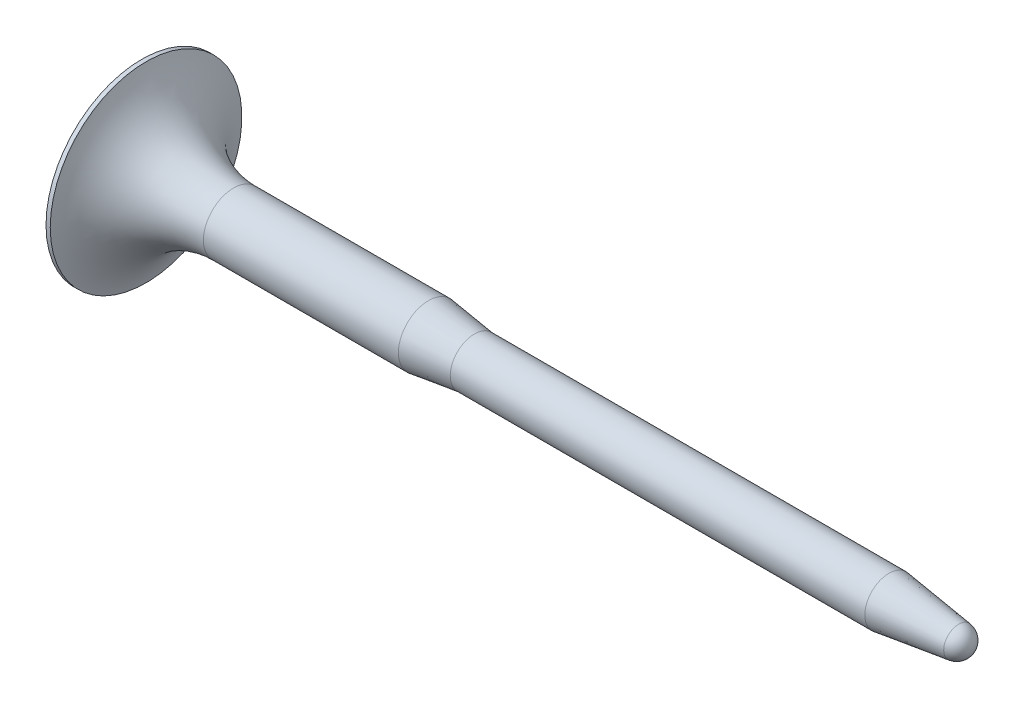
from build123d import *


with BuildPart() as part:
    # Sketch1 → Revolve1 (revolve)
    with BuildSketch(Plane.XY, mode=Mode.PRIVATE) as revolve1_sk:
        with BuildLine():
            Line((0, -4.03225), (0, 0))
            Line((0, 0), (34.925, 0))
            ThreePointArc((34.925, 0), (34.767418278, -0.418684593), (34.372884132, -0.629567487))
            Line((34.372884132, -0.629567487), (31.437637782, -1.016))
            Line((31.437637782, -1.016), (13.994321545, -1.016))
            Line((13.994321545, -1.016), (12.065, -1.27))
            Line((12.065, -1.27), (3.8608, -1.27))
            ThreePointArc((3.8608, -1.27), (1.558925, -2.037291667), (0.1778, -4.03225))
            Line((0.1778, -4.03225), (0, -4.03225))
        make_face()
    revolve(revolve1_sk.sketch.rotate(Axis((0, 0, 0), (1, 0, 0)), 270), axis=Axis((0, 0, 0), (1, 0, 0)))


solid = part.part
